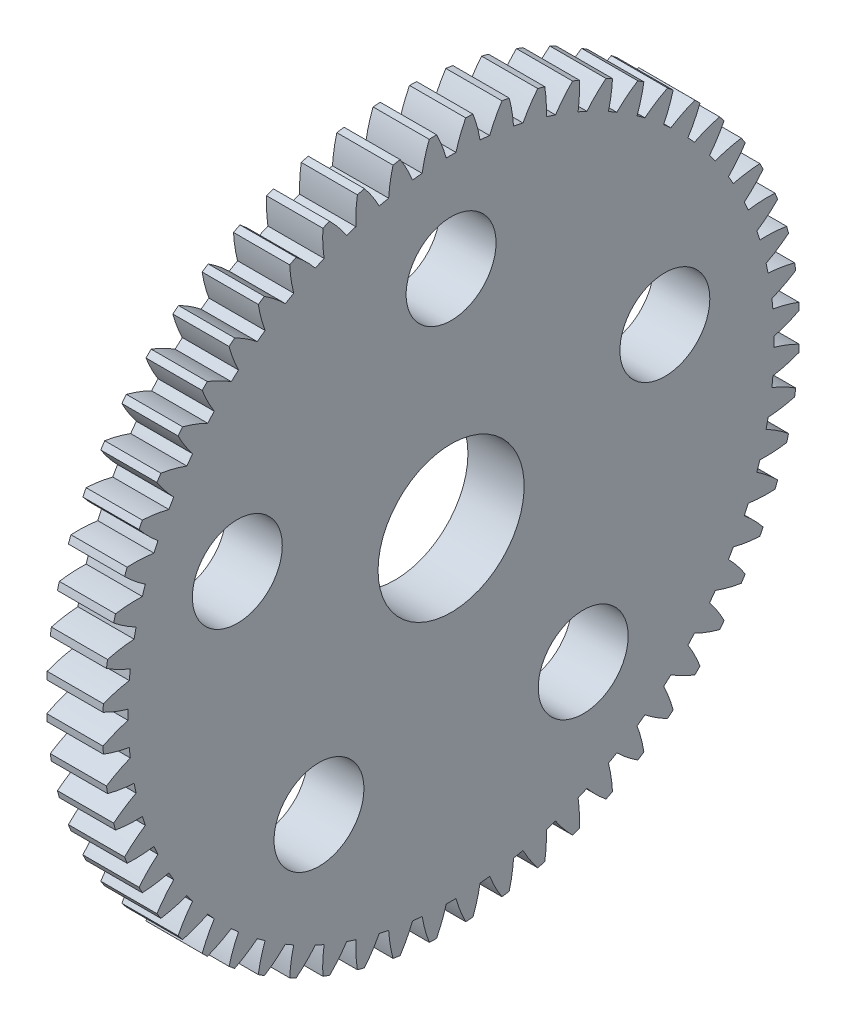
from build123d import *

# Parameters (mm, degrees)
BASPROSKE_W         = 5
BASPROSKE_H         = 31
TOOTHCUT_DEPTH      = 45.124822946
TEETHCUTS_COUNT     = 60
BORSKE_R            = 6.5
BORE_DEPTH          = 50.0000508
SKETCH_1_R          = 4
CUT_EXTRUDE_2_DEPTH = 5


with BuildPart() as part:
    # BasProSke → Base-Revolve (revolve)
    with BuildSketch(Plane(origin=(0, 0, 0), x_dir=(1, 0, 0), z_dir=(0, 1, 0)), mode=Mode.PRIVATE) as base_revolve_sk:
        with Locations((2.5, 15.5)):
            Rectangle(BASPROSKE_W, BASPROSKE_H)
    revolve(base_revolve_sk.sketch.rotate(Axis((-10, 0, 0), (1, 0, 0)), 180), axis=Axis((-10, 0, 0), (1, 0, 0)))

    # TooCutSke → ToothCut (cut, through all)
    with BuildSketch(Plane(origin=(0, 0, 0), x_dir=(0, 0, -1), z_dir=(1, 0, 0))):
        with BuildLine():
            ThreePointArc((0.430151971, 28.745781782), (0, 28.749), (-0.430151971, 28.745781782))
            ThreePointArc((-0.430151971, 28.745781782), (-0.81454129, 29.893990802), (-1.312684569, 30.997617721))
            ThreePointArc((-1.312684569, 30.997617721), (0, 31.0254), (1.312684569, 30.997617721))
            ThreePointArc((1.312684569, 30.997617721), (0.81454129, 29.893990802), (0.430151971, 28.745781782))
        make_face()
    toothcut = extrude(amount=TOOTHCUT_DEPTH, mode=Mode.SUBTRACT)

    # TeethCuts: ToothCut ×60 about axis
    teethcuts_axis = Axis((0, 0, 0), (1, 0, 0))
    for i in range(1, TEETHCUTS_COUNT):
        add(toothcut.rotate(teethcuts_axis, i * 360 / TEETHCUTS_COUNT), mode=Mode.SUBTRACT)

    # BorSke → Bore (cut, symmetric)
    with BuildSketch(Plane(origin=(0, 0, 0), x_dir=(0, 0, -1), z_dir=(1, 0, 0))):
        with Locations(Location((0, 0, 0), (0, 0, 180))):
            Circle(BORSKE_R)
    extrude(amount=BORE_DEPTH, both=True, mode=Mode.SUBTRACT)

    # 草图1 → 切除-拉伸2 (cut)
    with BuildSketch(Plane(origin=(5, 0, 0), x_dir=(0, 0, -1), z_dir=(1, 0, 0))):
        with Locations((0, 20)):
            Circle(SKETCH_1_R)
        with Locations((19.021130326, 6.180339887)):
            Circle(SKETCH_1_R)
        with Locations((11.755705046, -16.180339887)):
            Circle(SKETCH_1_R)
        with Locations((-11.755705046, -16.180339887)):
            Circle(SKETCH_1_R)
        with Locations((-19.021130326, 6.180339887)):
            Circle(SKETCH_1_R)
    extrude(amount=-CUT_EXTRUDE_2_DEPTH, mode=Mode.SUBTRACT)


solid = part.part
